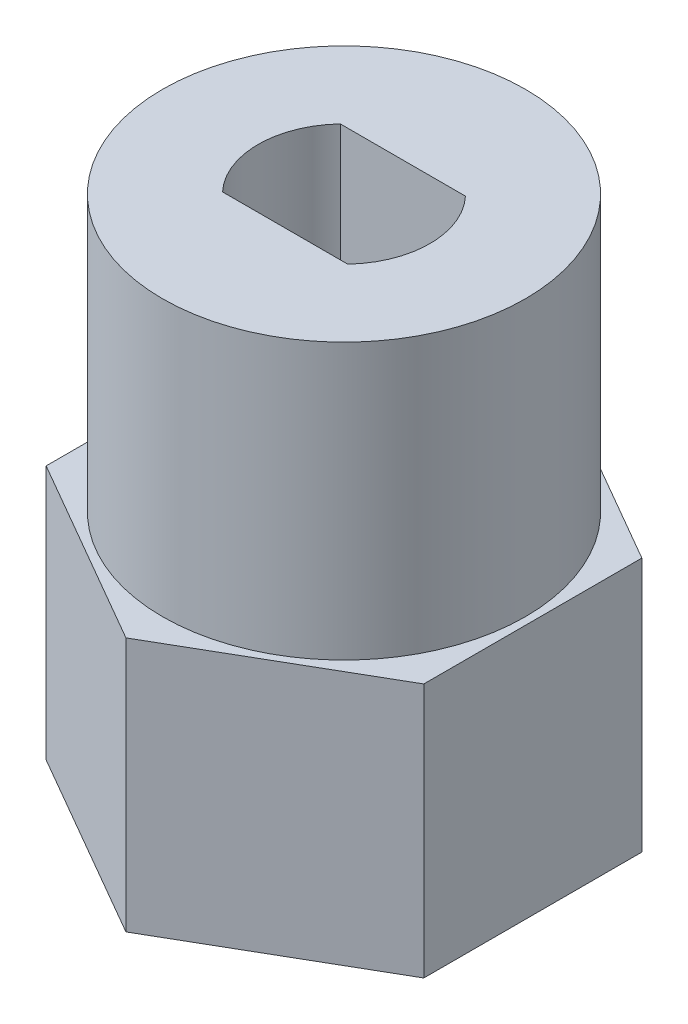
from build123d import *

# Parameters (mm, degrees)
SKETCH_1_R      = 1.6
EXTRUDE_1_DEPTH = 8
SKETCH_2_R      = 5.7
EXTRUDE_2_DEPTH = 8.65


with BuildPart() as part:
    # 草图1 → 凸台-拉伸1 (new body)
    with BuildSketch(Plane(origin=(0, 0, 0), x_dir=(1, 0, 0), z_dir=(0, 1, 0))):
        Polygon((0, 6.85), (-5.932274016, 3.425), (-5.932274016, -3.425), (0, -6.85), (5.932274016, -3.425), (5.932274016, 3.425), align=None)
        with Locations(Location((0, 0, 0), (0, 0, 270))):
            Circle(SKETCH_1_R, mode=Mode.SUBTRACT)
    extrude(amount=EXTRUDE_1_DEPTH)

    # 草图2 → 凸台-拉伸2 (add)
    with BuildSketch(Plane(origin=(0, 8, 0), x_dir=(1, 0, 0), z_dir=(0, 1, 0))):
        with Locations(Location((0, 0, 0), (0, 0, 270))):
            Circle(SKETCH_2_R)
        with BuildLine():
            Line((-1.966596044, 1.85), (1.966596044, 1.85))
            ThreePointArc((1.966596044, 1.85), (2.7, 0), (1.966596044, -1.85))
            Line((1.966596044, -1.85), (-1.966596044, -1.85))
            ThreePointArc((-1.966596044, -1.85), (-2.7, 0), (-1.966596044, 1.85))
        make_face(mode=Mode.SUBTRACT)
    extrude(amount=EXTRUDE_2_DEPTH)


solid = part.part
